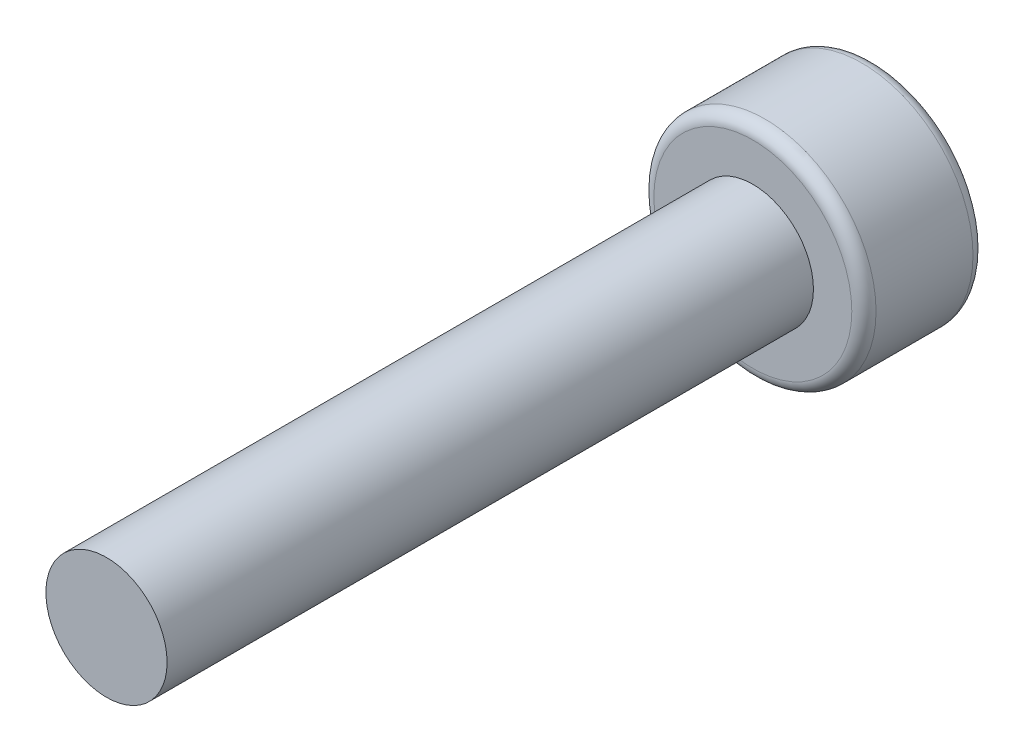
from build123d import *

# Parameters (mm, degrees)
SKETCH_1_R          = 2.75
EXTRUDE_1_DEPTH     = 3
SKETCH_2_R          = 1.5
EXTRUDE_2_DEPTH     = 16
FILLET_1_R          = 0.3
CUT_EXTRUDE_1_DEPTH = 2


with BuildPart() as part:
    # 草图1 → 凸台-拉伸1 (new body)
    with BuildSketch(Plane.XY):
        Circle(SKETCH_1_R)
    extrude(amount=EXTRUDE_1_DEPTH)

    # 草图2 → 凸台-拉伸2 (add)
    with BuildSketch(Plane.XY.offset(3)):
        Circle(SKETCH_2_R)
    extrude(amount=EXTRUDE_2_DEPTH)

    # 圆角1
    fillet_1_edges = [part.edges().sort_by_distance(p)[0] for p in [
        (-2.75, 0, 0),
        (-2.75, 0, 3),
    ]]
    fillet(fillet_1_edges, radius=FILLET_1_R)

    # 草图3 → 切除-拉伸1 (cut)
    with BuildSketch(Plane(origin=(0, 0, 0), x_dir=(-1, 0, 0), z_dir=(0, 0, -1))):
        Polygon((-0.820853493, 1.862408161), (-2.023319526, 0.220324103), (-1.202466033, -1.642084058), (0.820853493, -1.862408161), (2.023319526, -0.220324103), (1.202466033, 1.642084058), align=None)
    extrude(amount=-CUT_EXTRUDE_1_DEPTH, mode=Mode.SUBTRACT)


solid = part.part
